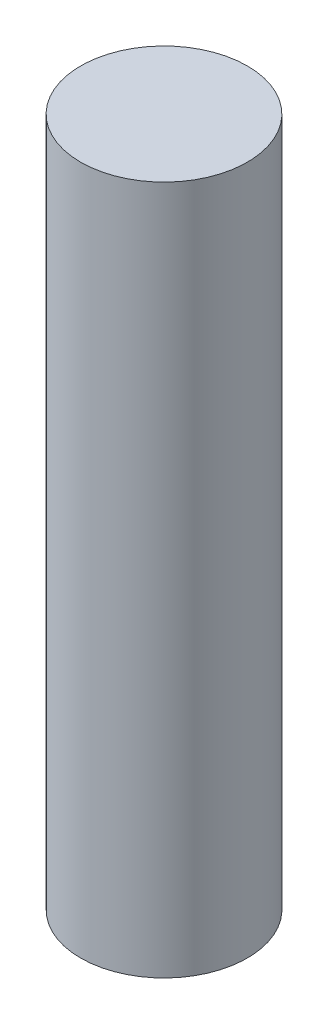
from build123d import *

# Parameters (mm, degrees)
SKETCH1_R           = 1.5
BOSS_EXTRUDE1_DEPTH = 12.4


with BuildPart() as part:
    # Sketch1 → Boss-Extrude1 (new body)
    with BuildSketch(Plane(origin=(0, 0, 0), x_dir=(1, 0, 0), z_dir=(0, 1, 0))):
        with Locations(Location((0, 0, 0), (0, 0, 90))):
            Circle(SKETCH1_R)
    extrude(amount=BOSS_EXTRUDE1_DEPTH)


solid = part.part
